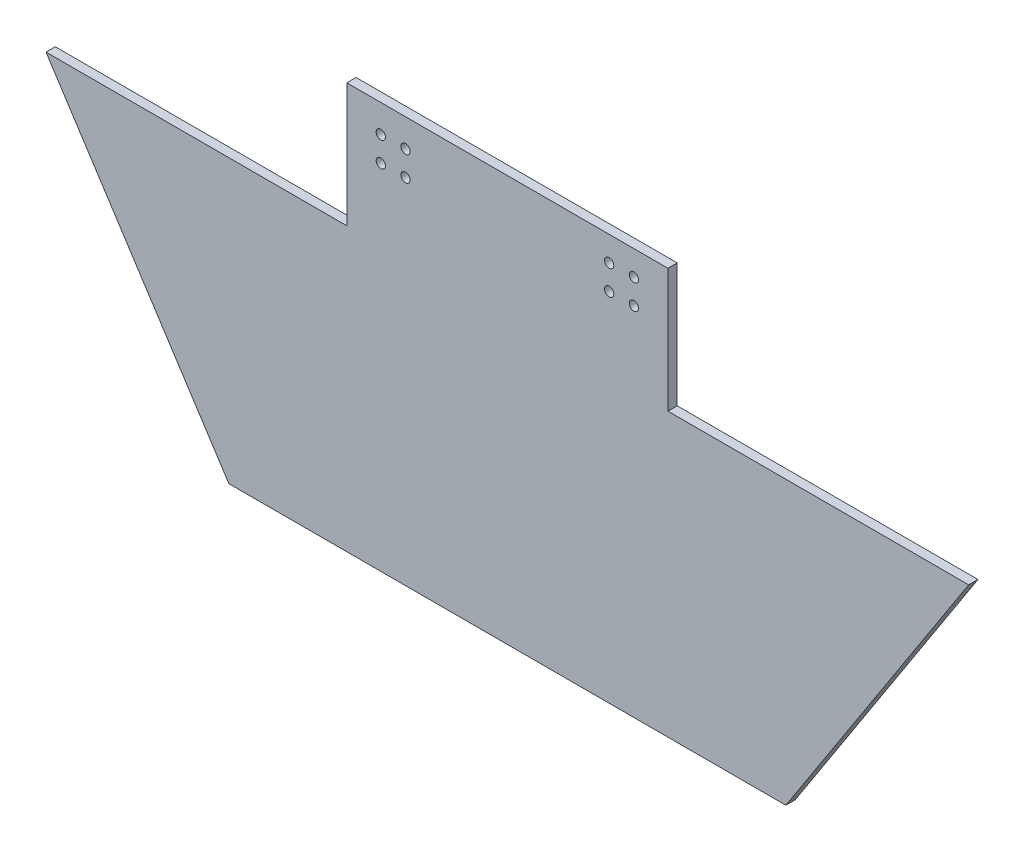
from build123d import *

# Parameters (mm, degrees)
EXTRUDE_1_DEPTH     = 3
CUT_EXTRUDE_1_DEPTH = 10
SKETCH_3_R          = 1.5
CUT_EXTRUDE_2_DEPTH = 10


with BuildPart() as part:
    # 草图1 → 凸台-拉伸1 (new body)
    with BuildSketch(Plane.XY):
        Polygon((100, 0), (250, 0), (250, -30), (330.569672928, -30), (265, -131.238140798), (85, -131.238140798), (19.430327072, -30), (100, -30), align=None)
    extrude(amount=EXTRUDE_1_DEPTH)

    # 草图2 → 切除-拉伸1 (cut)
    with BuildSketch(Plane.XY.offset(3)):
        Polygon((250, -40), (324.092897238, -40), (330.569672928, -30), (250, -30), (250, 0), (226.9, 0), (226.9, -40), align=None)
        Polygon((100, -40), (25.907102762, -40), (19.430327072, -30), (100, -30), (100, 0), (123.1, 0), (123.1, -40), align=None)
    extrude(amount=-CUT_EXTRUDE_1_DEPTH, mode=Mode.SUBTRACT)

    # 草图3 → 切除-拉伸2 (cut)
    with BuildSketch(Plane.XY.offset(3)):
        with Locations((134.1, -9)):
            Circle(SKETCH_3_R)
        with Locations((134.1, -17)):
            Circle(SKETCH_3_R)
        with Locations((142.1, -9)):
            Circle(SKETCH_3_R)
        with Locations((142.1, -17)):
            Circle(SKETCH_3_R)
        with Locations((207.9, -8)):
            Circle(SKETCH_3_R)
        with Locations((215.9, -8)):
            Circle(SKETCH_3_R)
        with Locations((207.9, -16)):
            Circle(SKETCH_3_R)
        with Locations((215.9, -16)):
            Circle(SKETCH_3_R)
    extrude(amount=-CUT_EXTRUDE_2_DEPTH, mode=Mode.SUBTRACT)


solid = part.part
